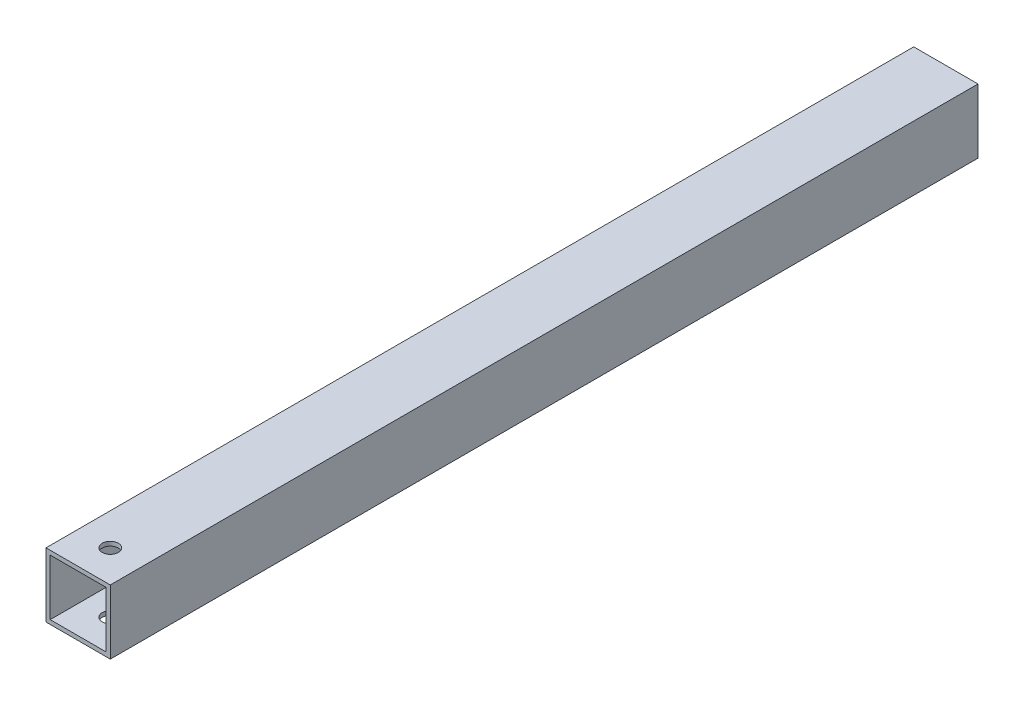
from build123d import *

# Parameters (mm, degrees)
SKETCH1_W           = 25.4
SKETCH1_H           = 25.4
BOSS_EXTRUDE1_DEPTH = 342.9
SKETCH2_W           = 22.098
SKETCH2_H           = 22.098
CUT_EXTRUDE1_DEPTH  = 357.529874987
SKETCH4_R           = 3.175
CUT_EXTRUDE3_DEPTH  = 354.770733702


with BuildPart() as part:
    # Sketch1 → Boss-Extrude1 (new body)
    with BuildSketch(Plane.XY):
        with Locations((-70.535581478, -38.339002092)):
            Rectangle(SKETCH1_W, SKETCH1_H)
    extrude(amount=BOSS_EXTRUDE1_DEPTH)

    # Sketch2 → Cut-Extrude1 (cut, through all)
    with BuildSketch(Plane.XY.offset(342.9)):
        with Locations((-70.535581478, -38.339002092)):
            Rectangle(SKETCH2_W, SKETCH2_H)
    extrude(amount=-CUT_EXTRUDE1_DEPTH, mode=Mode.SUBTRACT)

    # Sketch4 → Cut-Extrude3 (cut, through all)
    with BuildSketch(Plane.XZ.offset(51.039002092)):
        with Locations(Location((-70.535581478, 330.2, 0), (0, 0, 270))):
            Circle(SKETCH4_R)
    extrude(amount=-CUT_EXTRUDE3_DEPTH, mode=Mode.SUBTRACT)


solid = part.part
